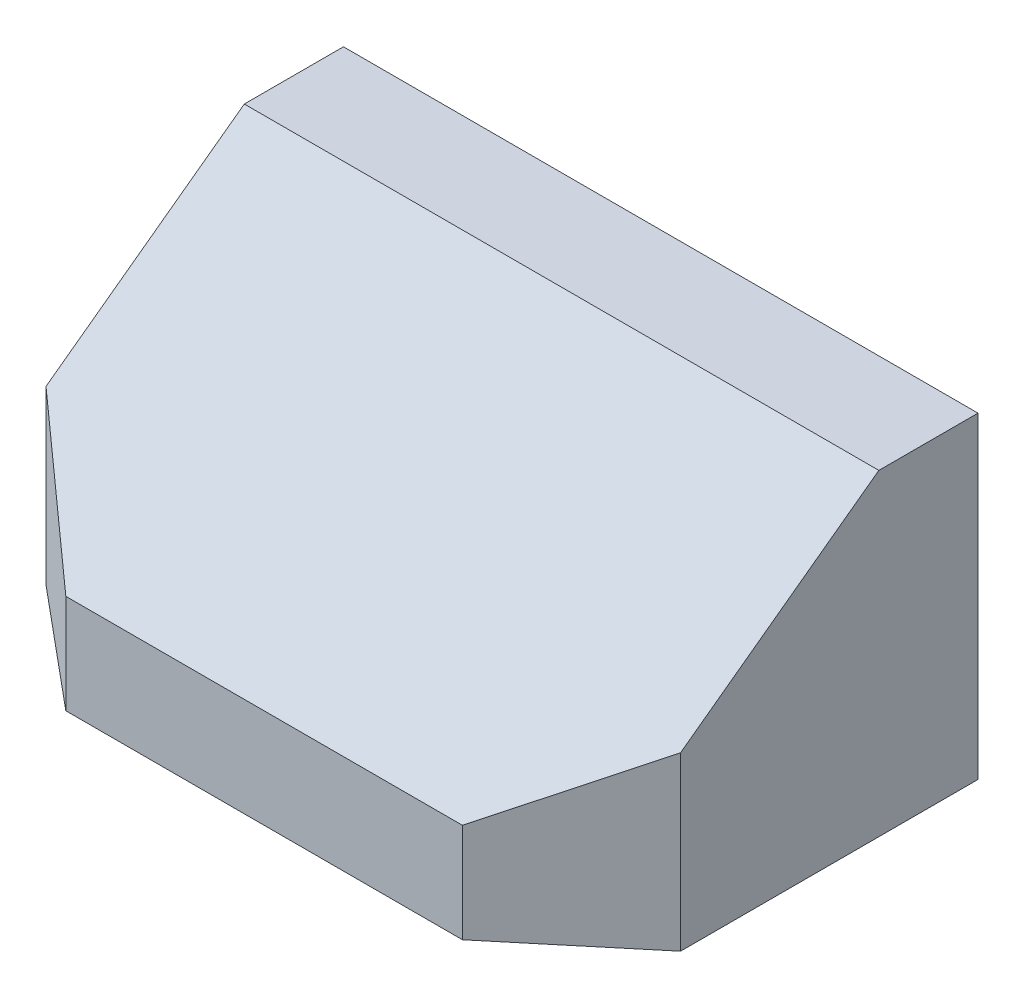
from build123d import *

# Parameters (mm, degrees)
BOSS_EXTRUDE1_DEPTH = 101.6
CUT_EXTRUDE1_DEPTH  = 101.6
CUT_EXTRUDE2_DEPTH  = 101.6


with BuildPart() as part:
    # Sketch1 → Boss-Extrude1 (new body)
    with BuildSketch(Plane(origin=(0, 0, 0), x_dir=(0, 0, -1), z_dir=(1, 0, 0))):
        Polygon((0, 0), (63.5, 0), (63.5, 50.8), (47.625, 50.8), (0, 15.875), align=None)
    extrude(amount=-BOSS_EXTRUDE1_DEPTH)

    # Sketch3 → Cut-Extrude1 (cut)
    with BuildSketch(Plane.XZ):
        Polygon((0, 0), (-19.05, 0), (0, -15.875), align=None)
    extrude(amount=-CUT_EXTRUDE1_DEPTH, mode=Mode.SUBTRACT)

    # Sketch4 → Cut-Extrude2 (cut)
    with BuildSketch(Plane.XZ):
        Polygon((-101.6, 0), (-82.55, 0), (-101.6, -15.875), align=None)
    extrude(amount=-CUT_EXTRUDE2_DEPTH, mode=Mode.SUBTRACT)


solid = part.part
